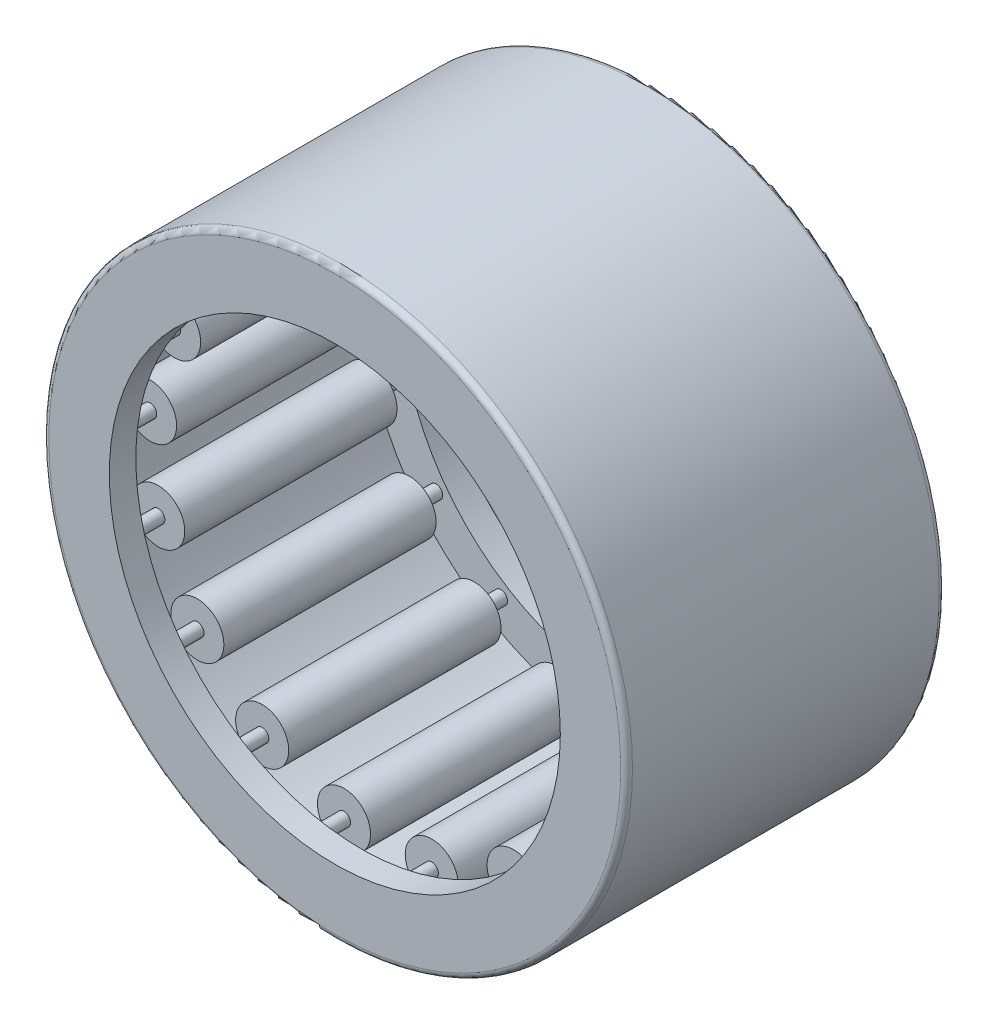
from build123d import *

# Parameters (mm, degrees)
SKETCH2_W         = 8
SKETCH2_H         = 0.75
SKETCH3_W         = 10
SKETCH3_H         = 0.25
CIRPATTERN1_COUNT = 17
CIRPATTERN1_ANGLE = 338.823529412
FILLET1_R         = 0.22


with BuildPart() as part:
    # Sketch1 → Revolve1 (revolve)
    with BuildSketch(Plane(origin=(0, 0, 0), x_dir=(0, 0, -1), z_dir=(1, 0, 0)), mode=Mode.PRIVATE) as revolve1_sk:
        Polygon((-6, 11), (6, 11), (6, 8.5), (5, 8.5), (5, 10), (-5, 10), (-5, 8.5), (-6, 8.5), align=None)
    revolve(revolve1_sk.sketch.rotate(Axis((0, 0, 6), (0, 0, -1)), 90), axis=Axis((0, 0, 6), (0, 0, -1)))

    # Fillet1
    fillet1_edges = [part.edges().sort_by_distance(p)[0] for p in [
        (-11, 0, 6),
        (-11, 0, -6),
    ]]
    fillet(fillet1_edges, radius=FILLET1_R)


with BuildPart() as body_2:
    # Sketch2 → Revolve2 (revolve)
    with BuildSketch(Plane(origin=(0, 0, 0), x_dir=(0, 0, -1), z_dir=(1, 0, 0)), mode=Mode.PRIVATE) as revolve2_sk:
        with Locations((0, 9.625)):
            Rectangle(SKETCH2_W, SKETCH2_H)
    revolve(revolve2_sk.sketch.rotate(Axis((0, 9, 4), (0, 0, -1)), 180), axis=Axis((0, 9, 4), (0, 0, -1)))


with BuildPart() as body_3:
    # Sketch3 → Revolve3 (revolve)
    with BuildSketch(Plane(origin=(0, 0, 0), x_dir=(0, 0, -1), z_dir=(1, 0, 0)), mode=Mode.PRIVATE) as revolve3_sk:
        with Locations((0, 9.125)):
            Rectangle(SKETCH3_W, SKETCH3_H)
    revolve(revolve3_sk.sketch.rotate(Axis((0, 9, 5), (0, 0, -1)), 90), axis=Axis((0, 9, 5), (0, 0, -1)))


with BuildPart() as cirpattern1_1:
    # CirPattern1: pattern copy
    add(body_2.part.rotate(Axis((0, 0, -6), (0, 0, 1)), 1 * CIRPATTERN1_ANGLE / (CIRPATTERN1_COUNT - 1)))


with BuildPart() as cirpattern1_2:
    # CirPattern1: pattern copy
    add(body_2.part.rotate(Axis((0, 0, -6), (0, 0, 1)), 2 * CIRPATTERN1_ANGLE / (CIRPATTERN1_COUNT - 1)))


with BuildPart() as cirpattern1_3:
    # CirPattern1: pattern copy
    add(body_2.part.rotate(Axis((0, 0, -6), (0, 0, 1)), 3 * CIRPATTERN1_ANGLE / (CIRPATTERN1_COUNT - 1)))


with BuildPart() as cirpattern1_4:
    # CirPattern1: pattern copy
    add(body_2.part.rotate(Axis((0, 0, -6), (0, 0, 1)), 4 * CIRPATTERN1_ANGLE / (CIRPATTERN1_COUNT - 1)))


with BuildPart() as cirpattern1_5:
    # CirPattern1: pattern copy
    add(body_2.part.rotate(Axis((0, 0, -6), (0, 0, 1)), 5 * CIRPATTERN1_ANGLE / (CIRPATTERN1_COUNT - 1)))


with BuildPart() as cirpattern1_6:
    # CirPattern1: pattern copy
    add(body_2.part.rotate(Axis((0, 0, -6), (0, 0, 1)), 6 * CIRPATTERN1_ANGLE / (CIRPATTERN1_COUNT - 1)))


with BuildPart() as cirpattern1_7:
    # CirPattern1: pattern copy
    add(body_2.part.rotate(Axis((0, 0, -6), (0, 0, 1)), 7 * CIRPATTERN1_ANGLE / (CIRPATTERN1_COUNT - 1)))


with BuildPart() as cirpattern1_8:
    # CirPattern1: pattern copy
    add(body_2.part.rotate(Axis((0, 0, -6), (0, 0, 1)), 8 * CIRPATTERN1_ANGLE / (CIRPATTERN1_COUNT - 1)))


with BuildPart() as cirpattern1_9:
    # CirPattern1: pattern copy
    add(body_2.part.rotate(Axis((0, 0, -6), (0, 0, 1)), 9 * CIRPATTERN1_ANGLE / (CIRPATTERN1_COUNT - 1)))


with BuildPart() as cirpattern1_10:
    # CirPattern1: pattern copy
    add(body_2.part.rotate(Axis((0, 0, -6), (0, 0, 1)), 10 * CIRPATTERN1_ANGLE / (CIRPATTERN1_COUNT - 1)))


with BuildPart() as cirpattern1_11:
    # CirPattern1: pattern copy
    add(body_2.part.rotate(Axis((0, 0, -6), (0, 0, 1)), 11 * CIRPATTERN1_ANGLE / (CIRPATTERN1_COUNT - 1)))


with BuildPart() as cirpattern1_12:
    # CirPattern1: pattern copy
    add(body_2.part.rotate(Axis((0, 0, -6), (0, 0, 1)), 12 * CIRPATTERN1_ANGLE / (CIRPATTERN1_COUNT - 1)))


with BuildPart() as cirpattern1_13:
    # CirPattern1: pattern copy
    add(body_2.part.rotate(Axis((0, 0, -6), (0, 0, 1)), 13 * CIRPATTERN1_ANGLE / (CIRPATTERN1_COUNT - 1)))


with BuildPart() as cirpattern1_14:
    # CirPattern1: pattern copy
    add(body_2.part.rotate(Axis((0, 0, -6), (0, 0, 1)), 14 * CIRPATTERN1_ANGLE / (CIRPATTERN1_COUNT - 1)))


with BuildPart() as cirpattern1_15:
    # CirPattern1: pattern copy
    add(body_2.part.rotate(Axis((0, 0, -6), (0, 0, 1)), 15 * CIRPATTERN1_ANGLE / (CIRPATTERN1_COUNT - 1)))


with BuildPart() as cirpattern1_16:
    # CirPattern1: pattern copy
    add(body_2.part.rotate(Axis((0, 0, -6), (0, 0, 1)), 16 * CIRPATTERN1_ANGLE / (CIRPATTERN1_COUNT - 1)))


with BuildPart() as cirpattern1_17:
    # CirPattern1: pattern copy
    add(body_3.part.rotate(Axis((0, 0, -6), (0, 0, 1)), 1 * CIRPATTERN1_ANGLE / (CIRPATTERN1_COUNT - 1)))


with BuildPart() as cirpattern1_18:
    # CirPattern1: pattern copy
    add(body_3.part.rotate(Axis((0, 0, -6), (0, 0, 1)), 2 * CIRPATTERN1_ANGLE / (CIRPATTERN1_COUNT - 1)))


with BuildPart() as cirpattern1_19:
    # CirPattern1: pattern copy
    add(body_3.part.rotate(Axis((0, 0, -6), (0, 0, 1)), 3 * CIRPATTERN1_ANGLE / (CIRPATTERN1_COUNT - 1)))


with BuildPart() as cirpattern1_20:
    # CirPattern1: pattern copy
    add(body_3.part.rotate(Axis((0, 0, -6), (0, 0, 1)), 4 * CIRPATTERN1_ANGLE / (CIRPATTERN1_COUNT - 1)))


with BuildPart() as cirpattern1_21:
    # CirPattern1: pattern copy
    add(body_3.part.rotate(Axis((0, 0, -6), (0, 0, 1)), 5 * CIRPATTERN1_ANGLE / (CIRPATTERN1_COUNT - 1)))


with BuildPart() as cirpattern1_22:
    # CirPattern1: pattern copy
    add(body_3.part.rotate(Axis((0, 0, -6), (0, 0, 1)), 6 * CIRPATTERN1_ANGLE / (CIRPATTERN1_COUNT - 1)))


with BuildPart() as cirpattern1_23:
    # CirPattern1: pattern copy
    add(body_3.part.rotate(Axis((0, 0, -6), (0, 0, 1)), 7 * CIRPATTERN1_ANGLE / (CIRPATTERN1_COUNT - 1)))


with BuildPart() as cirpattern1_24:
    # CirPattern1: pattern copy
    add(body_3.part.rotate(Axis((0, 0, -6), (0, 0, 1)), 8 * CIRPATTERN1_ANGLE / (CIRPATTERN1_COUNT - 1)))


with BuildPart() as cirpattern1_25:
    # CirPattern1: pattern copy
    add(body_3.part.rotate(Axis((0, 0, -6), (0, 0, 1)), 9 * CIRPATTERN1_ANGLE / (CIRPATTERN1_COUNT - 1)))


with BuildPart() as cirpattern1_26:
    # CirPattern1: pattern copy
    add(body_3.part.rotate(Axis((0, 0, -6), (0, 0, 1)), 10 * CIRPATTERN1_ANGLE / (CIRPATTERN1_COUNT - 1)))


with BuildPart() as cirpattern1_27:
    # CirPattern1: pattern copy
    add(body_3.part.rotate(Axis((0, 0, -6), (0, 0, 1)), 11 * CIRPATTERN1_ANGLE / (CIRPATTERN1_COUNT - 1)))


with BuildPart() as cirpattern1_28:
    # CirPattern1: pattern copy
    add(body_3.part.rotate(Axis((0, 0, -6), (0, 0, 1)), 12 * CIRPATTERN1_ANGLE / (CIRPATTERN1_COUNT - 1)))


with BuildPart() as cirpattern1_29:
    # CirPattern1: pattern copy
    add(body_3.part.rotate(Axis((0, 0, -6), (0, 0, 1)), 13 * CIRPATTERN1_ANGLE / (CIRPATTERN1_COUNT - 1)))


with BuildPart() as cirpattern1_30:
    # CirPattern1: pattern copy
    add(body_3.part.rotate(Axis((0, 0, -6), (0, 0, 1)), 14 * CIRPATTERN1_ANGLE / (CIRPATTERN1_COUNT - 1)))


with BuildPart() as cirpattern1_31:
    # CirPattern1: pattern copy
    add(body_3.part.rotate(Axis((0, 0, -6), (0, 0, 1)), 15 * CIRPATTERN1_ANGLE / (CIRPATTERN1_COUNT - 1)))


with BuildPart() as cirpattern1_32:
    # CirPattern1: pattern copy
    add(body_3.part.rotate(Axis((0, 0, -6), (0, 0, 1)), 16 * CIRPATTERN1_ANGLE / (CIRPATTERN1_COUNT - 1)))


solid = Compound([part.part, body_2.part, body_3.part, cirpattern1_1.part, cirpattern1_2.part, cirpattern1_3.part, cirpattern1_4.part, cirpattern1_5.part, cirpattern1_6.part, cirpattern1_7.part, cirpattern1_8.part, cirpattern1_9.part, cirpattern1_10.part, cirpattern1_11.part, cirpattern1_12.part, cirpattern1_13.part, cirpattern1_14.part, cirpattern1_15.part, cirpattern1_16.part, cirpattern1_17.part, cirpattern1_18.part, cirpattern1_19.part, cirpattern1_20.part, cirpattern1_21.part, cirpattern1_22.part, cirpattern1_23.part, cirpattern1_24.part, cirpattern1_25.part, cirpattern1_26.part, cirpattern1_27.part, cirpattern1_28.part, cirpattern1_29.part, cirpattern1_30.part, cirpattern1_31.part, cirpattern1_32.part])
